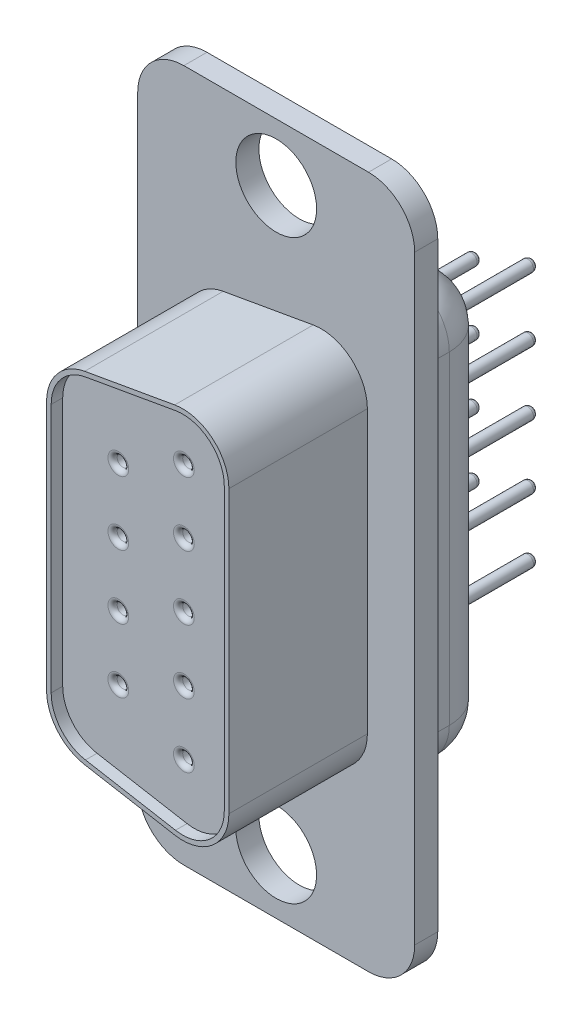
from build123d import *

# Parameters (mm, degrees)
SKETCH_1_W                 = 12
SKETCH_1_H                 = 30
EXTRUDE_910_DEPTH          = 1
SKETCH_2_R                 = 1.75
CUT_EXTRUDE_1_DEPTH        = 33.32645975
EXTRUDE_1_DEPTH            = 6
EXTRUDE_2_DEPTH            = 4
SKETCH_5_R                 = 0.25
EXTRUDE_3_DEPTH            = 4.6
SKETCH_6_R                 = 0.25
EXTRUDE_4_DEPTH            = 5
SKETCH_8_R                 = 0.25
CUT_EXTRUDE_4_DEPTH        = 5
SKETCH_9_R                 = 0.25
CUT_EXTRUDE_5_DEPTH        = 5
PATTERN_LINEAR_3_COUNT     = 3
PATTERN_LINEAR_3_PITCH     = 2.77
PATTERN_LINEAR_3_COL_COUNT = 3
PATTERN_LINEAR_3_COL_PITCH = 2.77
PATTERN_LINEAR_4_COUNT     = 3
PATTERN_LINEAR_4_PITCH     = 2.77
PATTERN_LINEAR_4_COL_COUNT = 2
PATTERN_LINEAR_4_COL_PITCH = 2.77
PATTERN_LINEAR_5_COUNT     = 3
PATTERN_LINEAR_5_PITCH     = 2.77
PATTERN_LINEAR_5_COL_COUNT = 3
PATTERN_LINEAR_5_COL_PITCH = 2.77
PATTERN_LINEAR_6_COUNT     = 3
PATTERN_LINEAR_6_PITCH     = 2.77
PATTERN_LINEAR_6_COL_COUNT = 2
PATTERN_LINEAR_6_COL_PITCH = 2.77
CUT_EXTRUDE_6_DEPTH        = 0.5
FILLET_1_R                 = 2
FILLET_2_R                 = 2
FILLET_3_R                 = 0.2
FILLET_4_R                 = 0.2


with BuildPart() as part:
    # Эскиз1 → Extrude 910 (new body)
    with BuildSketch(Plane.XY):
        with Locations((6, 15)):
            Rectangle(SKETCH_1_W, SKETCH_1_H)
    extrude(amount=EXTRUDE_910_DEPTH)

    # Эскиз2 → Вырез-Вытянуть1 (cut, through all)
    with BuildSketch(Plane.XY.offset(1)):
        with Locations((6, 27.5)):
            Circle(SKETCH_2_R)
        with Locations(Location((6, 2.5, 0), (0, 0, 180))):
            Circle(SKETCH_2_R)
    extrude(amount=-CUT_EXTRUDE_1_DEPTH, mode=Mode.SUBTRACT)

    # Эскиз3 → Бобышка-Вытянуть1 (add)
    with BuildSketch(Plane.XY.offset(1)):
        with BuildLine():
            Line((2.05, 9.587675225), (2.05, 20.412324775))
            ThreePointArc((2.05, 20.412324775), (2.517911114, 21.697899995), (3.702703645, 22.381940281))
            Line((3.702703645, 22.381940281), (7.602703645, 23.069615506))
            ThreePointArc((7.602703645, 23.069615506), (9.235575219, 22.632088886), (9.95, 21.1))
            Line((9.95, 21.1), (9.95, 8.9))
            ThreePointArc((9.95, 8.9), (9.235575219, 7.367911114), (7.602703645, 6.930384494))
            Line((7.602703645, 6.930384494), (3.702703645, 7.618059719))
            ThreePointArc((3.702703645, 7.618059719), (2.517911114, 8.302100005), (2.05, 9.587675225))
        make_face()
    extrude(amount=EXTRUDE_1_DEPTH)

    # Эскиз4 → Бобышка-Вытянуть2 (add)
    with BuildSketch(Plane(origin=(0, 0, 0), x_dir=(-1, 0, 0), z_dir=(0, 0, -1))):
        with BuildLine():
            Line((-8.066139084, 23.959142019), (-3.066139084, 22.848030908))
            ThreePointArc((-3.066139084, 22.848030908), (-1.939916375, 22.147111574), (-1.5, 20.895656787))
            Line((-1.5, 20.895656787), (-1.5, 9.104343213))
            ThreePointArc((-1.5, 9.104343213), (-1.939916375, 7.852888426), (-3.066139084, 7.151969092))
            Line((-3.066139084, 7.151969092), (-8.066139084, 6.040857981))
            ThreePointArc((-8.066139084, 6.040857981), (-9.751454787, 6.433148477), (-10.5, 7.993232102))
            Line((-10.5, 7.993232102), (-10.5, 22.006767898))
            ThreePointArc((-10.5, 22.006767898), (-9.751454787, 23.566851523), (-8.066139084, 23.959142019))
        make_face()
    extrude(amount=EXTRUDE_2_DEPTH)

    # Эскиз5 → Бобышка-Вытянуть3 (add)
    with BuildSketch(Plane(origin=(0, 0, -4), x_dir=(-1, 0, 0), z_dir=(0, 0, -1))):
        with Locations((-7.5, 15)):
            Circle(SKETCH_5_R)
    extrude_3 = extrude(amount=EXTRUDE_3_DEPTH)

    # Эскиз6 → Бобышка-Вытянуть4 (add)
    with BuildSketch(Plane(origin=(0, 0, -4), x_dir=(-1, 0, 0), z_dir=(0, 0, -1))):
        with Locations((-4.66, 16.385)):
            Circle(SKETCH_6_R)
    extrude_4 = extrude(amount=EXTRUDE_4_DEPTH)

    # Эскиз8 → Вырез-Вытянуть4 (cut)
    with BuildSketch(Plane.XY.offset(7)):
        with Locations(Location((7.5, 15, 0), (0, 0, 180))):
            Circle(SKETCH_8_R)
    cut_extrude_4 = extrude(amount=-CUT_EXTRUDE_4_DEPTH, mode=Mode.SUBTRACT)

    # Эскиз9 → Вырез-Вытянуть5 (cut)
    with BuildSketch(Plane.XY.offset(7)):
        with Locations(Location((4.66, 16.385, 0), (0, 0, 180))):
            Circle(SKETCH_9_R)
    cut_extrude_5 = extrude(amount=-CUT_EXTRUDE_5_DEPTH, mode=Mode.SUBTRACT)

    # Линейный массив3: Бобышка-Вытянуть3 ×3
    with Locations(*[(0, i * PATTERN_LINEAR_3_PITCH, 0) for i in range(1, PATTERN_LINEAR_3_COUNT)]):
        add(extrude_3)

    # Линейный массив3 col: Бобышка-Вытянуть3 ×3
    with Locations(*[(0, -i * PATTERN_LINEAR_3_COL_PITCH, 0) for i in range(1, PATTERN_LINEAR_3_COL_COUNT)]):
        add(extrude_3)

    # Линейный массив4: Бобышка-Вытянуть4 ×3
    with Locations(*[(0, -i * PATTERN_LINEAR_4_PITCH, 0) for i in range(1, PATTERN_LINEAR_4_COUNT)]):
        add(extrude_4)

    # Линейный массив4 col: Бобышка-Вытянуть4 ×2
    with Locations(*[(0, i * PATTERN_LINEAR_4_COL_PITCH, 0) for i in range(1, PATTERN_LINEAR_4_COL_COUNT)]):
        add(extrude_4)

    # Линейный массив5: Вырез-Вытянуть4 ×3
    with Locations(*[(0, -i * PATTERN_LINEAR_5_PITCH, 0) for i in range(1, PATTERN_LINEAR_5_COUNT)]):
        add(cut_extrude_4, mode=Mode.SUBTRACT)

    # Линейный массив5 col: Вырез-Вытянуть4 ×3
    with Locations(*[(0, i * PATTERN_LINEAR_5_COL_PITCH, 0) for i in range(1, PATTERN_LINEAR_5_COL_COUNT)]):
        add(cut_extrude_4, mode=Mode.SUBTRACT)

    # Линейный массив6: Вырез-Вытянуть5 ×3
    with Locations(*[(0, -i * PATTERN_LINEAR_6_PITCH, 0) for i in range(1, PATTERN_LINEAR_6_COUNT)]):
        add(cut_extrude_5, mode=Mode.SUBTRACT)

    # Линейный массив6 col: Вырез-Вытянуть5 ×2
    with Locations(*[(0, i * PATTERN_LINEAR_6_COL_PITCH, 0) for i in range(1, PATTERN_LINEAR_6_COL_COUNT)]):
        add(cut_extrude_5, mode=Mode.SUBTRACT)

    # Эскиз14 → Вырез-Вытянуть6 (cut)
    with BuildSketch(Plane.XY.offset(7)):
        with BuildLine():
            Line((7.63743328, 22.872653955), (3.73743328, 22.184978731))
            ThreePointArc((3.73743328, 22.184978731), (2.671120002, 21.569342473), (2.25, 20.412324775))
            Line((2.25, 20.412324775), (2.25, 9.587675225))
            ThreePointArc((2.25, 9.587675225), (2.671120002, 8.430657527), (3.73743328, 7.815021269))
            Line((3.73743328, 7.815021269), (7.63743328, 7.127346045))
            ThreePointArc((7.63743328, 7.127346045), (9.107017697, 7.521120002), (9.75, 8.9))
            Line((9.75, 8.9), (9.75, 21.1))
            ThreePointArc((9.75, 21.1), (9.107017697, 22.478879998), (7.63743328, 22.872653955))
        make_face()
    extrude(amount=-CUT_EXTRUDE_6_DEPTH, mode=Mode.SUBTRACT)

    # Скругление1
    fillet_1_edges = [part.edges().sort_by_distance(p)[0] for p in [
        (0, 30, 0.5),
        (12, 30, 0.5),
        (12, 0, 0.5),
        (0, 0, 0.5),
    ]]
    fillet(fillet_1_edges, radius=FILLET_1_R)

    # Скругление2
    fillet_2_edges = [part.edges().sort_by_distance(p)[0] for p in [
        (9.751454787, 23.566851523, -4),
        (10.5, 15, -4),
        (9.751454787, 6.433148477, -4),
        (5.566139084, 6.596413537, -4),
        (1.939916375, 7.852888426, -4),
        (1.5, 15, -4),
        (1.939916375, 22.147111574, -4),
        (5.566139084, 23.403586463, -4),
    ]]
    fillet(fillet_2_edges, radius=FILLET_2_R)

    # Скругление3
    fillet_3_edges = [part.edges().sort_by_distance(p)[0] for p in [
        (7.75, 15, 6.5),
        (4.91, 16.385, 6.5),
        (7.75, 12.23, 6.5),
        (7.75, 9.46, 6.5),
        (7.75, 17.77, 6.5),
        (7.75, 20.54, 6.5),
        (4.91, 13.615, 6.5),
        (4.91, 10.845, 6.5),
        (4.91, 19.155, 6.5),
    ]]
    fillet(fillet_3_edges, radius=FILLET_3_R)

    # Скругление4
    fillet_4_edges = [part.edges().sort_by_distance(p)[0] for p in [
        (4.91, 13.615, -9),
        (4.91, 10.845, -9),
        (4.91, 19.155, -9),
        (7.75, 15, -8.6),
        (4.91, 16.385, -9),
        (7.75, 17.77, -8.6),
        (7.75, 20.54, -8.6),
        (7.75, 12.23, -8.6),
        (7.75, 9.46, -8.6),
    ]]
    fillet(fillet_4_edges, radius=FILLET_4_R)


solid = part.part
